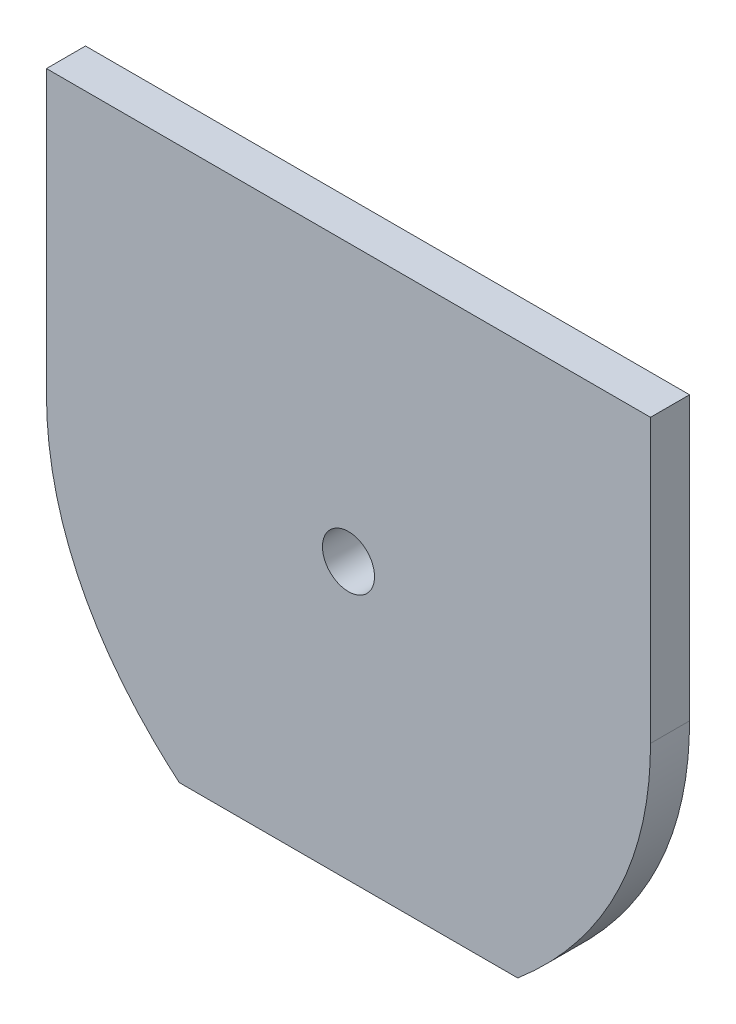
from build123d import *

# Parameters (mm, degrees)
BOSS_EXTRUDE1_DEPTH = 0.75
CUT_EXTRUDE1_REACH  = 14.106
SKETCH2_R           = 0.5


with BuildPart() as part:
    # Sketch1 → Boss-Extrude1 (new body)
    with BuildSketch(Plane.XY):
        with BuildLine():
            Line((-3.25, 0), (3.25, 0))
            add(Edge.make_bspline(
                [(5.8, 5.176744099), (5.8, 3.033630296), (4.795112478, 1.311398784), (3.25, 0)],
                knots=[0, 0, 0, 0, 1, 1, 1, 1], degree=3))
            Line((5.8, 5.176744099), (5.8, 10.6))
            Line((5.8, 10.6), (-5.8, 10.6))
            Line((-5.8, 10.6), (-5.8, 5.176744099))
            add(Edge.make_bspline(
                [(-5.8, 5.176744099), (-5.8, 3.033630296), (-4.795112478, 1.311398784), (-3.25, 0)],
                knots=[0, 0, 0, 0, 1, 1, 1, 1], degree=3))
        make_face()
    extrude(amount=BOSS_EXTRUDE1_DEPTH)

    # Sketch2 → Cut-Extrude1 (cut, up to next)
    with BuildSketch(Plane.XY.offset(0.75), mode=Mode.PRIVATE) as cut_extrude1_sk1:
        with Locations((0, 5.3)):
            Circle(SKETCH2_R)
    cut_extrude1_tool1 = extrude(cut_extrude1_sk1.sketch, amount=-CUT_EXTRUDE1_REACH, mode=Mode.PRIVATE) & part.part
    add(cut_extrude1_tool1.solids().sort_by_distance((0, 5.3, 0.75))[0], mode=Mode.SUBTRACT)


solid = part.part
